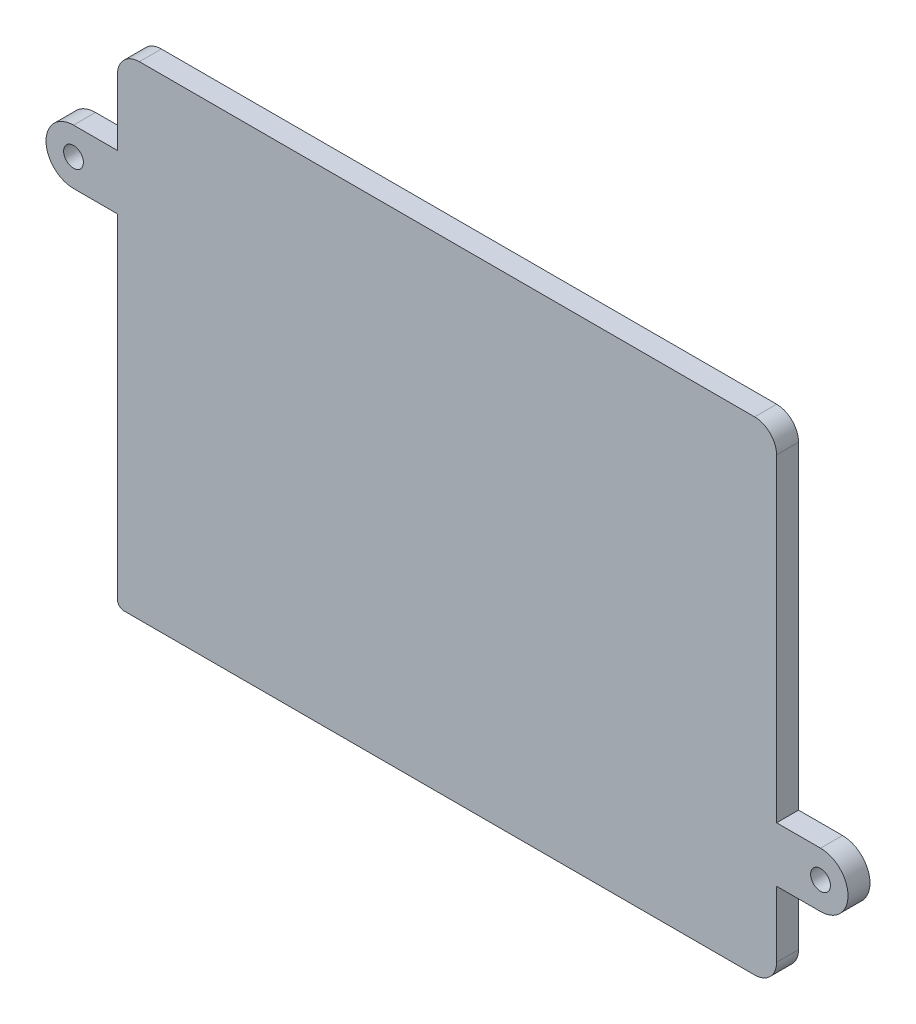
from build123d import *

# Parameters (mm, degrees)
SKETCH1_R           = 2.25
BOSS_EXTRUDE1_DEPTH = 5
BOSS_EXTRUDE2_DEPTH = 2


with BuildPart() as part:
    # Sketch1 → Boss-Extrude1 (new body)
    with BuildSketch(Plane.XY):
        with BuildLine():
            Line((-75, 35), (-85, 35))
            ThreePointArc((-85, 35), (-91.25, 28.75), (-85, 22.5))
            Line((-85, 22.5), (-75, 22.5))
            Line((-75, 22.5), (-75, -53.5))
            ThreePointArc((-75, -53.5), (-74.560660172, -54.560660172), (-73.5, -55))
            Line((-73.5, -55), (70, -55))
            ThreePointArc((70, -55), (73.535533906, -53.535533906), (75, -50))
            Line((75, -50), (75, -35))
            Line((75, -35), (85, -35))
            ThreePointArc((85, -35), (91.25, -28.75), (85, -22.5))
            Line((85, -22.5), (75, -22.5))
            Line((75, -22.5), (75, 50))
            ThreePointArc((75, 50), (73.535533906, 53.535533906), (70, 55))
            Line((70, 55), (-70, 55))
            ThreePointArc((-70, 55), (-73.535533906, 53.535533906), (-75, 50))
            Line((-75, 50), (-75, 35))
        make_face()
        with Locations((-85, 28.75)):
            Circle(SKETCH1_R, mode=Mode.SUBTRACT)
        with Locations((85, -28.75)):
            Circle(SKETCH1_R, mode=Mode.SUBTRACT)
    extrude(amount=BOSS_EXTRUDE1_DEPTH)

    # Sketch3 → Boss-Extrude2 (add)
    with BuildSketch(Plane(origin=(0, 0, 0), x_dir=(-1, 0, 0), z_dir=(0, 0, -1))):
        with BuildLine():
            Line((-68.5, -45), (-68.5, 45))
            ThreePointArc((-68.5, 45), (-67.474873734, 47.474873734), (-65, 48.5))
            Line((-65, 48.5), (65, 48.5))
            ThreePointArc((65, 48.5), (67.474873734, 47.474873734), (68.5, 45))
            Line((68.5, 45), (68.5, -45))
            ThreePointArc((68.5, -45), (67.474873734, -47.474873734), (65, -48.5))
            Line((65, -48.5), (-65, -48.5))
            ThreePointArc((-65, -48.5), (-67.474873734, -47.474873734), (-68.5, -45))
        make_face()
    extrude(amount=BOSS_EXTRUDE2_DEPTH)


solid = part.part
